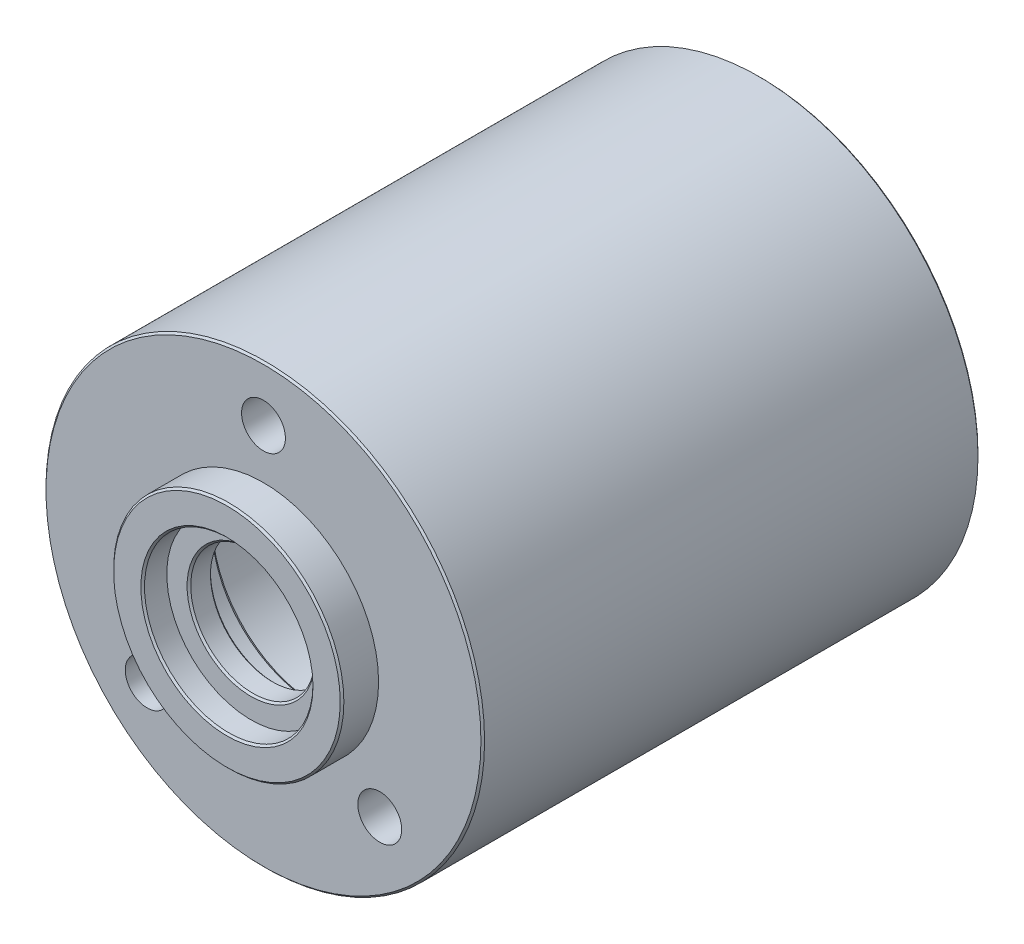
from build123d import *

# Parameters (mm, degrees)
SKETCH2_R          = 3
CUT_EXTRUDE1_DEPTH = 23
SKETCH3_R          = 3.25
SKETCH3_R_2        = 3.4
SKETCH3_R_3        = 3.697443322
CUT_EXTRUDE2_DEPTH = 23


with BuildPart() as part:
    # Sketch1 → Revolve1 (revolve)
    with BuildSketch(Plane(origin=(0, 0, 0), x_dir=(0, 0, -1), z_dir=(1, 0, 0)), mode=Mode.PRIVATE) as revolve1_sk:
        Polygon((0.25, 15.75), (5, 15.75), (5, 29.75), (5.25, 30), (72.75, 30), (73, 29.75), (73, 28.85), (72, 28.85), (72, 26.85), (73, 26.85), (73, 14.85), (72.75, 14.6), (12.575, 14.6), (12, 14.025), (6.5, 14.025), (6.5, 8.75), (6.25, 8.5), (3.55, 8.5), (3.3, 8.75), (3.3, 11.525), (0.25, 11.525), (0, 11.775), (0, 15.5), align=None)
    revolve(revolve1_sk.sketch.rotate(Axis((0, 0, 0), (0, 0, -1)), 90), axis=Axis((0, 0, 0), (0, 0, -1)))

    # Sketch2 → Cut-Extrude1 (cut)
    with BuildSketch(Plane.XY.offset(-5)):
        with Locations((15.909902577, -15.909902577)):
            Circle(SKETCH2_R)
        with Locations((-15.909902577, -15.909902577)):
            Circle(SKETCH2_R)
        with Locations((0, 22.5)):
            Circle(SKETCH2_R)
    extrude(amount=-CUT_EXTRUDE1_DEPTH, mode=Mode.SUBTRACT)

    # Sketch3 → Cut-Extrude2 (cut)
    with BuildSketch(Plane(origin=(0, 0, -73), x_dir=(-1, 0, 0), z_dir=(0, 0, -1))):
        with Locations((0, -19.763693495)):
            Circle(SKETCH3_R)
        with Locations((-18.796389484, -6.107317162)):
            Circle(SKETCH3_R)
        with Locations((-11.616807567, 15.989163909)):
            Circle(SKETCH3_R)
        with Locations((11.616807567, 15.989163909)):
            Circle(SKETCH3_R)
        with Locations((18.796389484, -6.107317162)):
            Circle(SKETCH3_R)
        with Locations((0, 21.2)):
            Circle(SKETCH3_R_2)
        with Locations((-12.45, -17.15)):
            Circle(SKETCH3_R_2)
        with Locations((12.45, -17.15)):
            Circle(SKETCH3_R_2)
        with Locations((-20.112696309, 6.901022254)):
            Circle(SKETCH3_R_3)
        with Locations((20.112696309, 6.901022254)):
            Circle(SKETCH3_R_3)
    extrude(amount=-CUT_EXTRUDE2_DEPTH, mode=Mode.SUBTRACT)


solid = part.part
